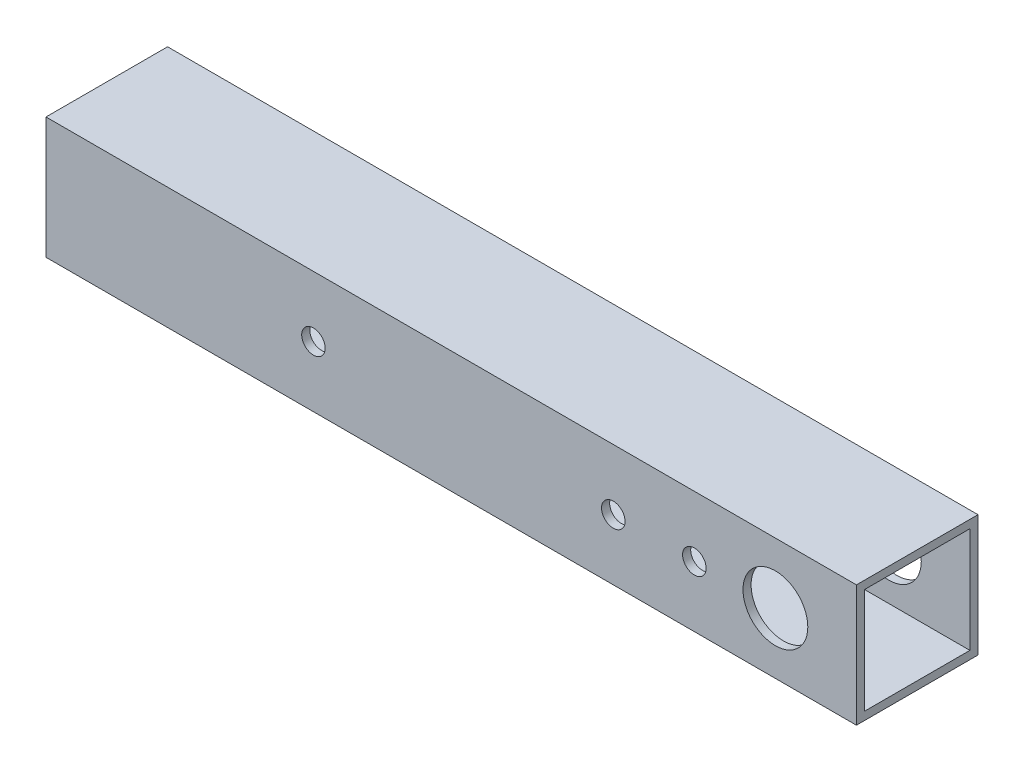
from build123d import *

# Parameters (mm, degrees)
SKETCH_11_W         = 15
SKETCH_11_H         = 15
SKETCH_11_W_2       = 13
SKETCH_11_H_2       = 13
F_15X15X1_1_DEPTH   = 100
SKETCH_12_R         = 1.45
CUT_EXTRUDE_1_DEPTH = 22
SKETCH_13_R         = 4
SKETCH_13_R_2       = 1.45
CUT_EXTRUDE_2_DEPTH = 102.396498953


with BuildPart() as part:
    # 草图11 → 铝管 15X15X1(1) (new body)
    with BuildSketch(Plane.YZ):
        Rectangle(SKETCH_11_W, SKETCH_11_H)
        Rectangle(SKETCH_11_W_2, SKETCH_11_H_2, mode=Mode.SUBTRACT)
    extrude(amount=F_15X15X1_1_DEPTH)

    # 草图12 → 切除-拉伸1 (cut)
    with BuildSketch(Plane.XY.offset(7.5)):
        with Locations((33, 0)):
            Circle(SKETCH_12_R)
    extrude(amount=-CUT_EXTRUDE_1_DEPTH, mode=Mode.SUBTRACT)

    # 草图13 → 切除-拉伸2 (cut, through all)
    with BuildSketch(Plane.XY.offset(7.5)):
        with Locations((90, 0)):
            Circle(SKETCH_13_R)
        with Locations((80, 0)):
            Circle(SKETCH_13_R_2)
        with Locations((70, 0)):
            Circle(SKETCH_13_R_2)
    extrude(amount=-CUT_EXTRUDE_2_DEPTH, mode=Mode.SUBTRACT)


solid = part.part
